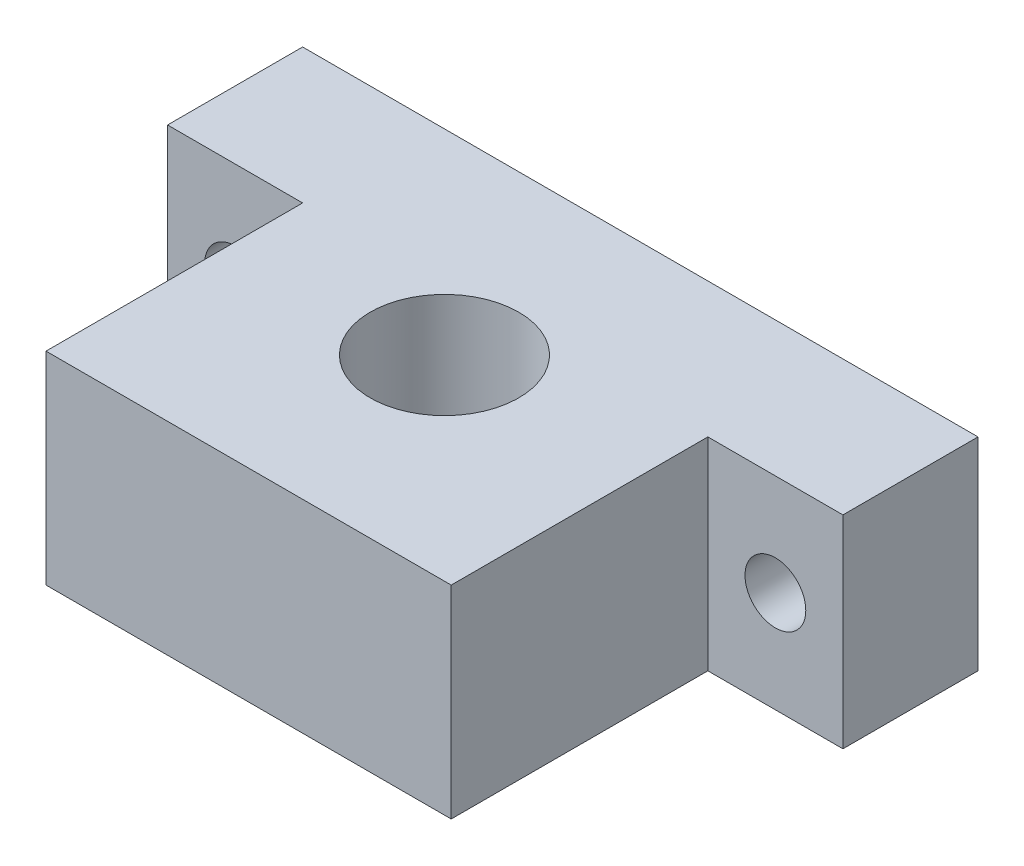
from build123d import *

# Parameters (mm, degrees)
BOSS_EXTRUDE1_DEPTH  = 58
SKETCH3_R            = 11
CUT_EXTRUDE1_DEPTH   = 77.774006375
SKETCH4_W            = 20
SKETCH4_H            = 30
CUT_EXTRUDE2_DEPTH   = 38
M8_CLEARANCE_HOLE1_D = 9


with BuildPart() as part:
    # Sketch1 → Boss-Extrude1 (new body)
    with BuildSketch(Plane(origin=(0, 2.518676762, -29.699029015), x_dir=(1, 0, 0), z_dir=(0, 0, 1))):
        Polygon((-64.126560257, 671.967635092), (-14.126560257, 671.967635092), (35.873439743, 671.967635092), (35.873439743, 701.967635092), (-64.126560257, 701.967635092), align=None)
    extrude(amount=BOSS_EXTRUDE1_DEPTH)

    # Sketch3 → Cut-Extrude1 (cut, through all)
    with BuildSketch(Plane.XZ.offset(-674.486311854)):
        with Locations(Location((-14.126560257, -0.699029015, 0), (0, 0, 270))):
            Circle(SKETCH3_R)
    extrude(amount=-CUT_EXTRUDE1_DEPTH, mode=Mode.SUBTRACT)

    # Sketch4 → Cut-Extrude2 (cut)
    with BuildSketch(Plane.XY.offset(28.300970985)):
        with Locations((-54.126560257, 689.486311854)):
            Rectangle(SKETCH4_W, SKETCH4_H)
        with Locations((25.873439743, 689.486311854)):
            Rectangle(SKETCH4_W, SKETCH4_H)
    extrude(amount=-CUT_EXTRUDE2_DEPTH, mode=Mode.SUBTRACT)

    # M8 Clearance Hole1 (through all)
    with Locations(Plane(origin=(-5.422124321, 631.407959219, -9.699029015), x_dir=(1, 0, 0), z_dir=(0, 0, 1))):
        with Locations((-48.704435936, -458.836111538), (-48.704435936, -493.836111538), (31.295564064, -458.836111538), (31.295564064, -493.836111538), (-48.704435936, 58.078352635), (31.295564064, 58.078352635)):
            Hole(M8_CLEARANCE_HOLE1_D / 2)


solid = part.part
